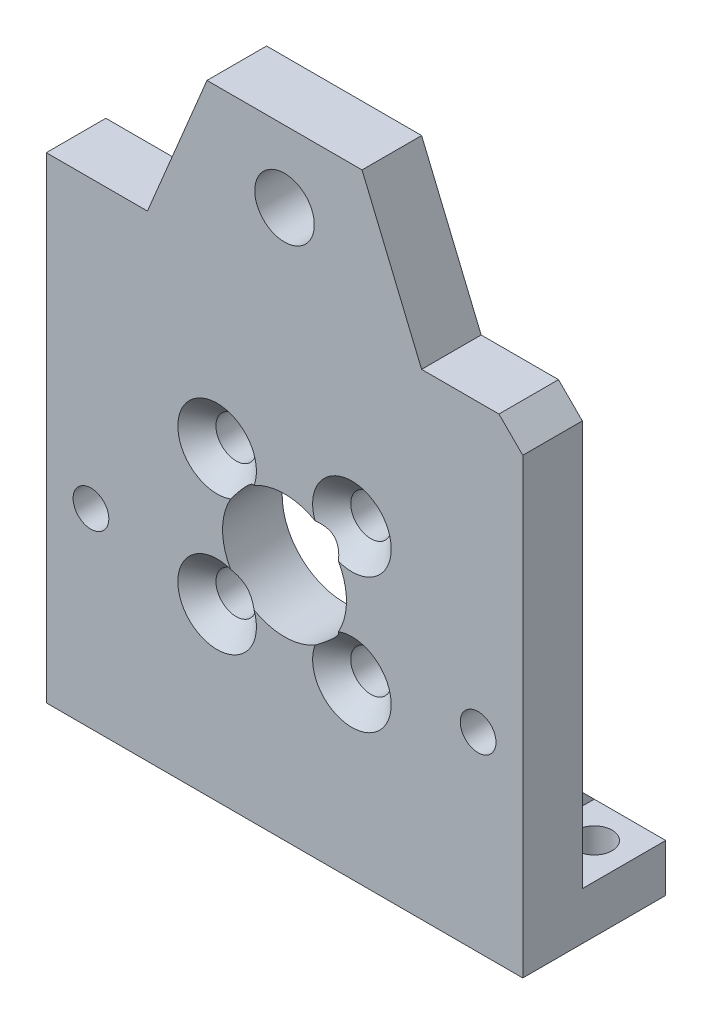
from build123d import *

# Parameters (mm, degrees)
SKETCH_1_W                   = 40
SKETCH_1_H                   = 40
SKETCH_1_R                   = 5.2
SKETCH_1_R_2                 = 1.6
EXTRUDE_1_DEPTH              = 5
HOLE_WIZARD_1_D              = 3
CHAMFER_1_SIZE               = 2
HOLE_WIZARD_M3_2_D           = 3.4
HOLE_WIZARD_M3_2_CSINK_D     = 6.6
HOLE_WIZARD_M3_2_CSINK_ANGLE = 90
SKETCH_7_R                   = 2.5
EXTRUDE_2_DEPTH              = 5
SKETCH_10_W                  = 9
SKETCH_10_H                  = 7
SKETCH_10_R                  = 1.5
EXTRUDE_4_DEPTH              = 4
EXTRUDE_6_DEPTH              = 3


with BuildPart() as part:
    # 草图1 → 凸台-拉伸1 (new body)
    with BuildSketch(Plane.XY):
        Rectangle(SKETCH_1_W, SKETCH_1_H)
        Circle(SKETCH_1_R, mode=Mode.SUBTRACT)
        with Locations((5.656854249, 5.656854249)):
            Circle(SKETCH_1_R_2, mode=Mode.SUBTRACT)
        with Locations((5.656854249, -5.656854249)):
            Circle(SKETCH_1_R_2, mode=Mode.SUBTRACT)
        with Locations((-5.656854249, -5.656854249)):
            Circle(SKETCH_1_R_2, mode=Mode.SUBTRACT)
        with Locations((-5.656854249, 5.656854249)):
            Circle(SKETCH_1_R_2, mode=Mode.SUBTRACT)
    extrude(amount=EXTRUDE_1_DEPTH)

    # 孔1 (through all)
    with Locations(Plane(origin=(16.25, -4, 5), x_dir=(1, 0, 0), z_dir=(0, 0, 1))):
        with Locations((0, 0), (-32.5, 0)):
            Hole(HOLE_WIZARD_1_D / 2)

    # 倒角1
    chamfer_1_edges = [part.edges().sort_by_distance(p)[0] for p in [
        (20, 20, 2.5),
    ]]
    chamfer(chamfer_1_edges, length=CHAMFER_1_SIZE)

    # M3 十字槽沉头木螺钉的锥形沉头孔2 (through all)
    with Locations(Plane.XY.offset(5)):
        with Locations((-5.656854249, 5.656854249), (5.656854249, 5.656854249), (5.656854249, -5.656854249), (-5.656854249, -5.656854249)):
            CounterSinkHole(HOLE_WIZARD_M3_2_D / 2, HOLE_WIZARD_M3_2_CSINK_D / 2, counter_sink_angle=HOLE_WIZARD_M3_2_CSINK_ANGLE)

    # 草图7 → 凸台-拉伸2 (add)
    with BuildSketch(Plane(origin=(0, 0, 0), x_dir=(-1, 0, 0), z_dir=(0, 0, -1))):
        Polygon((-11.507772726, 20), (-6.507772726, 20), (6.507772726, 20), (11.507772726, 20), (6.507772726, 32), (-6.507772726, 32), align=None)
        with Locations((0, 26)):
            Circle(SKETCH_7_R, mode=Mode.SUBTRACT)
    extrude(amount=-EXTRUDE_2_DEPTH)

    # 草图10 → 凸台-拉伸4 (add)
    with BuildSketch(Plane.XZ.offset(20)):
        with Locations((15.5, -3.5)):
            Rectangle(SKETCH_10_W, SKETCH_10_H)
        with Locations(Location((17, -4, 0), (0, 0, 270))):
            Circle(SKETCH_10_R, mode=Mode.SUBTRACT)
    extrude_4 = extrude(amount=-EXTRUDE_4_DEPTH)

    # 草图12 → 凸台-拉伸6 (add)
    with BuildSketch(Plane.ZY.offset(-11)):
        Polygon((-7, -16), (0, -9), (0, -16), align=None)
    extrude_6 = extrude(amount=-EXTRUDE_6_DEPTH)

    # 镜向2: 凸台-拉伸4, 凸台-拉伸6 across plane
    add(extrude_4.mirror(Plane(origin=(0, 0, 0), x_dir=(0, 0, 1), z_dir=(1, 0, 0))))
    add(extrude_6.mirror(Plane(origin=(0, 0, 0), x_dir=(0, 0, 1), z_dir=(1, 0, 0))))


solid = part.part
